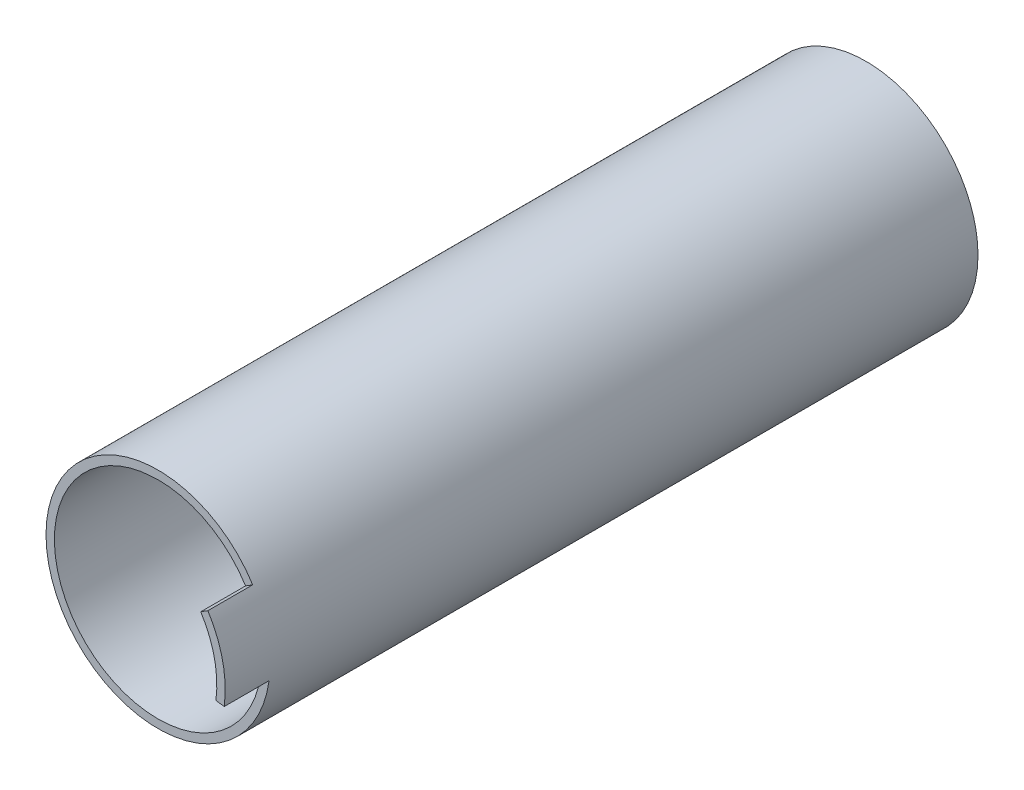
from build123d import *

# Parameters (mm, degrees)
SKETCH_2_R          = 20
SKETCH_2_R_2        = 18.5
EXTRUDE_1_DEPTH     = 126.4
SKETCH_5_R          = 3
EXTRUDE_3_DEPTH     = 126.4
CUT_EXTRUDE1_DEPTH  = 59
CUT_EXTRUDE2_DEPTH  = 59
BOSS_EXTRUDE4_DEPTH = 8
SKETCH3_R           = 3
BOSS_EXTRUDE6_DEPTH = 58.6


with BuildPart() as part:
    # Эскиз2 → Бобышка-Вытянуть1 (new body)
    with BuildSketch(Plane.XY):
        Circle(SKETCH_2_R)
        Circle(SKETCH_2_R_2, mode=Mode.SUBTRACT)
    extrude(amount=EXTRUDE_1_DEPTH)

    # Эскиз5 → Бобышка-Вытянуть3 (add, through all)
    with BuildSketch(Plane(origin=(0, 0, 0), x_dir=(-1, 0, 0), z_dir=(0, 0, -1))):
        with BuildLine():
            Line((0, 18.5), (0, 9.219544457))
            ThreePointArc((0, 9.219544457), (-0.725705562, 6.35915669), (-2.727272727, 4.190702026))
            ThreePointArc((-2.727272727, 4.190702026), (-0.405405405, -4.983537544), (3.368749585, 3.694797184))
            ThreePointArc((3.368749585, 3.694797184), (1.743983113, 6.158250179), (1.490138787, 9.098323274))
            Line((1.490138787, 9.098323274), (2.990122527, 18.256756757))
            ThreePointArc((2.990122527, 18.256756757), (1.5, 18.439088915), (0, 18.5))
        make_face()
        Circle(SKETCH_5_R, mode=Mode.SUBTRACT)
    extrude(amount=-EXTRUDE_3_DEPTH)

    # Sketch1 → Cut-Extrude1 (cut)
    with BuildSketch(Plane(origin=(0, 0, 0), x_dir=(-1, 0, 0), z_dir=(0, 0, -1))):
        with BuildLine():
            Line((0, 18.5), (2.990122527, 18.256756757))
            ThreePointArc((2.990122527, 18.256756757), (-1.5, -18.439088915), (0, 18.5))
        make_face()
    extrude(amount=-CUT_EXTRUDE1_DEPTH, mode=Mode.SUBTRACT)

    # Sketch2 → Cut-Extrude2 (cut)
    with BuildSketch(Plane.XY.offset(126.4)):
        with BuildLine():
            Line((0, 18.5), (-2.990122527, 18.256756757))
            ThreePointArc((-2.990122527, 18.256756757), (1.50000041, -18.439093959), (0, 18.5))
        make_face()
    extrude(amount=-CUT_EXTRUDE2_DEPTH, mode=Mode.SUBTRACT)

    # Sketch6 → Boss-Extrude4 (add)
    with BuildSketch(Plane.XY.offset(126.4)):
        with BuildLine():
            Line((16.901505151, 10.692947377), (15.633892265, 9.890976324))
            ThreePointArc((15.633892265, 9.890976324), (18.073966336, 3.947371391), (18.334053323, -2.472344789))
            Line((18.334053323, -2.472344789), (19.820598187, -2.672805177))
            ThreePointArc((19.820598187, -2.672805177), (19.539423066, 4.267428531), (16.901505151, 10.692947377))
        make_face()
    extrude(amount=BOSS_EXTRUDE4_DEPTH)


with BuildPart() as body_2:
    # Sketch3 → Boss-Extrude6 (new body)
    with BuildSketch(Plane.XY):
        with BuildLine():
            Line((5, 0), (5, 16.770509831))
            ThreePointArc((5, 16.770509831), (0, 17.5), (-5, 16.770509831))
            Line((-5, 16.770509831), (-5, 0))
            ThreePointArc((-5, 0), (0, -5), (5, 0))
        make_face()
        with Locations(Location((0, 0, 0), (0, 0, 180))):
            Circle(SKETCH3_R, mode=Mode.SUBTRACT)
    extrude(amount=BOSS_EXTRUDE6_DEPTH)


solid = Compound([part.part, body_2.part])
